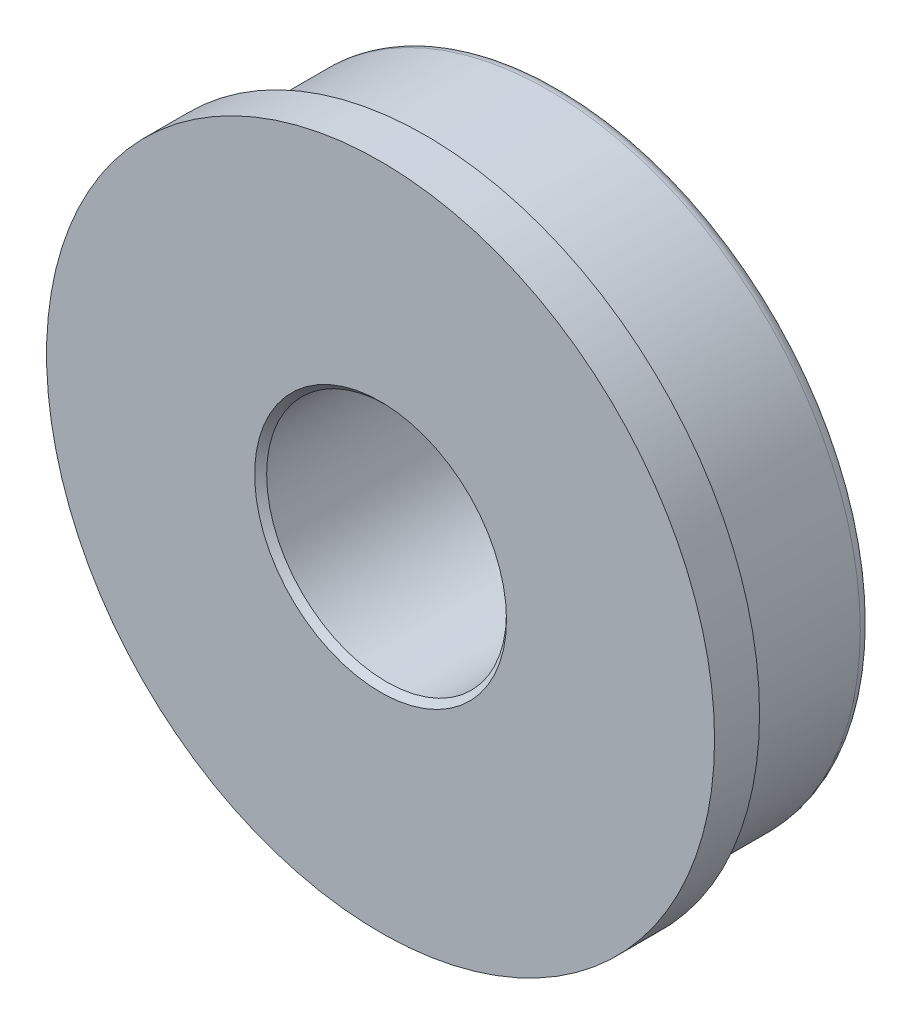
from build123d import *

# Parameters (mm, degrees)
SKETCH_1_R      = 26
SKETCH_1_R_2    = 10
EXTRUDE_1_DEPTH = 7.5
SKETCH_2_R      = 27.85
SKETCH_2_R_2    = 26
EXTRUDE_2_DEPTH = 3.75
CHAMFER_1_SIZE  = 0.5
FILLET_1_R      = 1


with BuildPart() as part:
    # 草图1 → 凸台-拉伸1 (new, symmetric)
    with BuildSketch(Plane.XY):
        Circle(SKETCH_1_R)
        Circle(SKETCH_1_R_2, mode=Mode.SUBTRACT)
    extrude(amount=EXTRUDE_1_DEPTH, both=True)

    # 草图2 → 凸台-拉伸2 (add)
    with BuildSketch(Plane.XY.offset(7.5)):
        Circle(SKETCH_2_R)
        Circle(SKETCH_2_R_2, mode=Mode.SUBTRACT)
    extrude(amount=-EXTRUDE_2_DEPTH)

    # 倒角1
    chamfer_1_edges = [part.edges().sort_by_distance(p)[0] for p in [
        (-10, 0, -7.5),
        (-10, 0, 7.5),
    ]]
    chamfer(chamfer_1_edges, length=CHAMFER_1_SIZE)

    # 圆角1
    fillet_1_edges = [part.edges().sort_by_distance(p)[0] for p in [
        (-26, 0, -7.5),
    ]]
    fillet(fillet_1_edges, radius=FILLET_1_R)


solid = part.part
